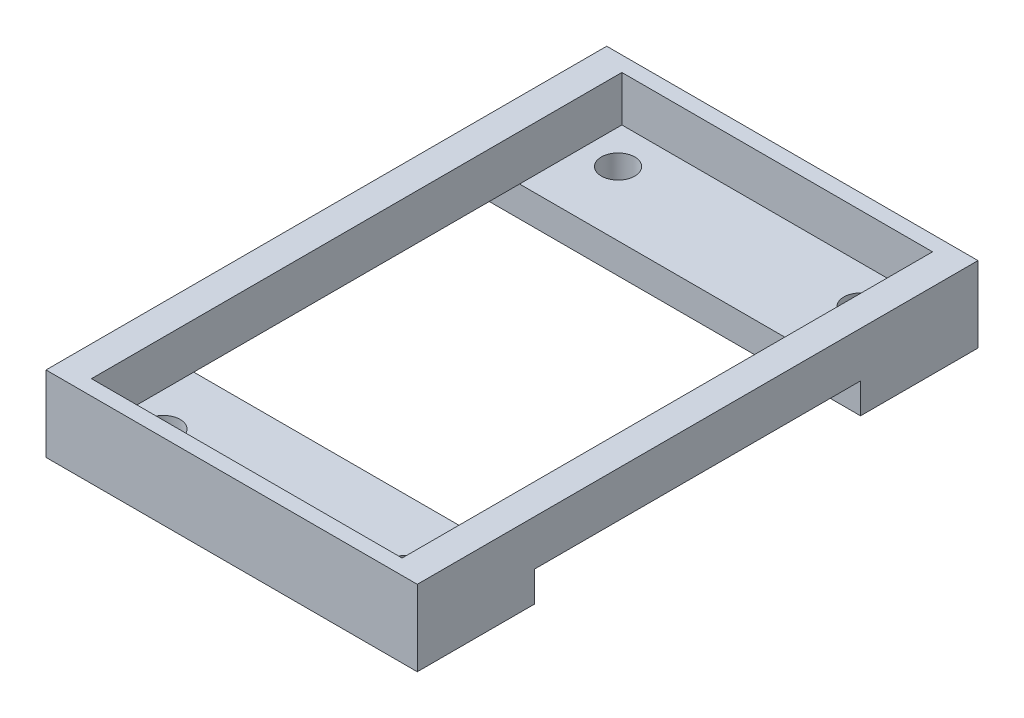
from build123d import *

# Parameters (mm, degrees)
SKETCH_1_W          = 20.5
SKETCH_1_H          = 35
EXTRUDE_1_DEPTH     = 2
SKETCH_2_W          = 24.5
SKETCH_2_H          = 37
SKETCH_2_W_2        = 20.5
SKETCH_2_H_2        = 35
EXTRUDE_2_DEPTH     = 5
SKETCH_3_R          = 1.1
CUT_EXTRUDE_1_DEPTH = 23.744504831
SKETCH_4_W          = 24.5
SKETCH_4_H          = 21.5
CUT_EXTRUDE_4_DEPTH = 2


with BuildPart() as part:
    # 草图1 → 凸台-拉伸1 (new body)
    with BuildSketch(Plane(origin=(0, 0, 0), x_dir=(1, 0, 0), z_dir=(0, 1, 0))):
        Rectangle(SKETCH_1_W, SKETCH_1_H)
    extrude(amount=EXTRUDE_1_DEPTH)

    # 草图2 → 凸台-拉伸2 (add)
    with BuildSketch(Plane(origin=(0, 0, 0), x_dir=(1, 0, 0), z_dir=(0, 1, 0))):
        Rectangle(SKETCH_2_W, SKETCH_2_H)
        Rectangle(SKETCH_2_W_2, SKETCH_2_H_2, mode=Mode.SUBTRACT)
    extrude(amount=EXTRUDE_2_DEPTH)

    # 草图3 → 切除-拉伸1 (cut, through all)
    with BuildSketch(Plane.XZ):
        with Locations(Location((-8, 15, 0), (0, 0, 270))):
            Circle(SKETCH_3_R)
        with Locations(Location((8, 15, 0), (0, 0, 270))):
            Circle(SKETCH_3_R)
        with Locations(Location((8, -15, 0), (0, 0, 270))):
            Circle(SKETCH_3_R)
        with Locations(Location((-8, -15, 0), (0, 0, 270))):
            Circle(SKETCH_3_R)
    extrude(amount=-CUT_EXTRUDE_1_DEPTH, mode=Mode.SUBTRACT)

    # 草图4 → 切除-拉伸4 (cut)
    with BuildSketch(Plane.XZ):
        Rectangle(SKETCH_4_W, SKETCH_4_H)
    extrude(amount=-CUT_EXTRUDE_4_DEPTH, mode=Mode.SUBTRACT)


solid = part.part
